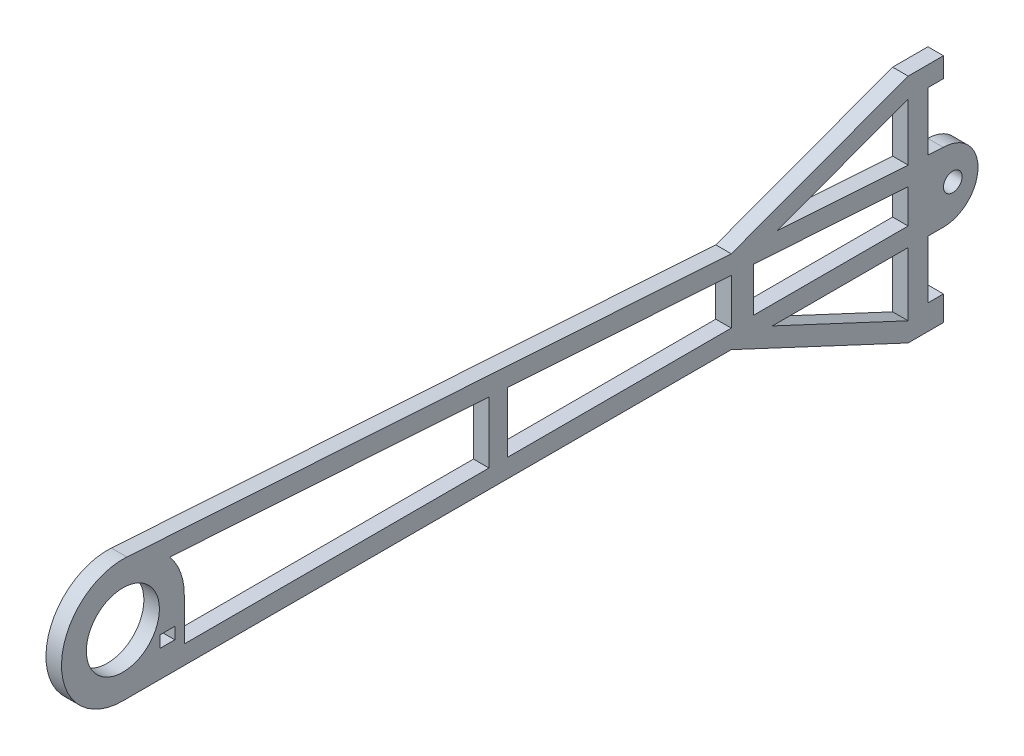
from build123d import *

# Parameters (mm, degrees)
SKETCH1_W           = 1.5113
SKETCH1_H           = 1.1938
SKETCH1_R           = 3.7338
SKETCH1_R_2         = 0.9525
BOSS_EXTRUDE1_DEPTH = 1.5875


with BuildPart() as part:
    # Sketch1 → Boss-Extrude1 (new body)
    with BuildSketch(Plane(origin=(0, 0, 0), x_dir=(0, 0, -1), z_dir=(1, 0, 0))):
        with BuildLine():
            Line((82.296, -12.181036366), (82.296, -6.2738))
            Line((82.296, -6.2738), (83.8708, -6.2738))
            ThreePointArc((83.8708, -6.2738), (87.402991636, -2.741608364), (83.8708, 0.790583272))
            Line((83.8708, 0.790583272), (82.296, 0.893791599))
            Line((82.296, 0.893791599), (82.296, 6.868963634))
            Line((82.296, 6.868963634), (83.8708, 6.868963634))
            Line((83.8708, 6.868963634), (83.8708, 8.900963634))
            Line((83.8708, 8.900963634), (80.264, 8.900963634))
            Line((80.264, 8.900963634), (62.185099246, 2.211808127))
            Line((62.185099246, 2.211808127), (0.410288477, 6.260369782))
            ThreePointArc((0.410288477, 6.260369782), (-6.270441547, 0.205254114), (0, -6.2738))
            Line((0, -6.2738), (62.185099246, -6.2738))
            Line((62.185099246, -6.2738), (80.264, -14.721036366))
            Line((80.264, -14.721036366), (83.8708, -14.721036366))
            Line((83.8708, -14.721036366), (83.8708, -12.181036366))
            Line((83.8708, -12.181036366), (82.296, -12.181036366))
        make_face()
        Polygon((39.325099246, 1.800906775), (62.185099246, 0.302721378), (62.185099246, -4.3688), (39.325099246, -4.3688), align=None, mode=Mode.SUBTRACT)
        Polygon((64.471099246, 0.152902838), (80.264, -0.882123115), (80.264, -4.3688), (64.471099246, -4.3688), align=None, mode=Mode.SUBTRACT)
        Polygon((66.3852906, -6.2738), (80.264, -6.2738), (80.264, -12.758527161), align=None, mode=Mode.SUBTRACT)
        with Locations((4.55295, -2.921)):
            Rectangle(SKETCH1_W, SKETCH1_H, mode=Mode.SUBTRACT)
        Circle(SKETCH1_R, mode=Mode.SUBTRACT)
        with BuildLine():
            Line((4.778751005, 4.064985273), (37.420099246, 1.925755558))
            Line((37.420099246, 1.925755558), (37.420099246, -4.3688))
            Line((37.420099246, -4.3688), (6.2738, -4.3688))
            Line((6.2738, -4.3688), (6.2738, 0))
            ThreePointArc((6.2738, 0), (5.888187094, 2.165599038), (4.778751005, 4.064985273))
        make_face(mode=Mode.SUBTRACT)
        Polygon((80.264, 1.026963634), (66.848818814, 1.906159984), (80.264, 6.869748995), align=None, mode=Mode.SUBTRACT)
        with Locations((84.8233, -2.741608364)):
            Circle(SKETCH1_R_2, mode=Mode.SUBTRACT)
    extrude(amount=BOSS_EXTRUDE1_DEPTH)


solid = part.part
